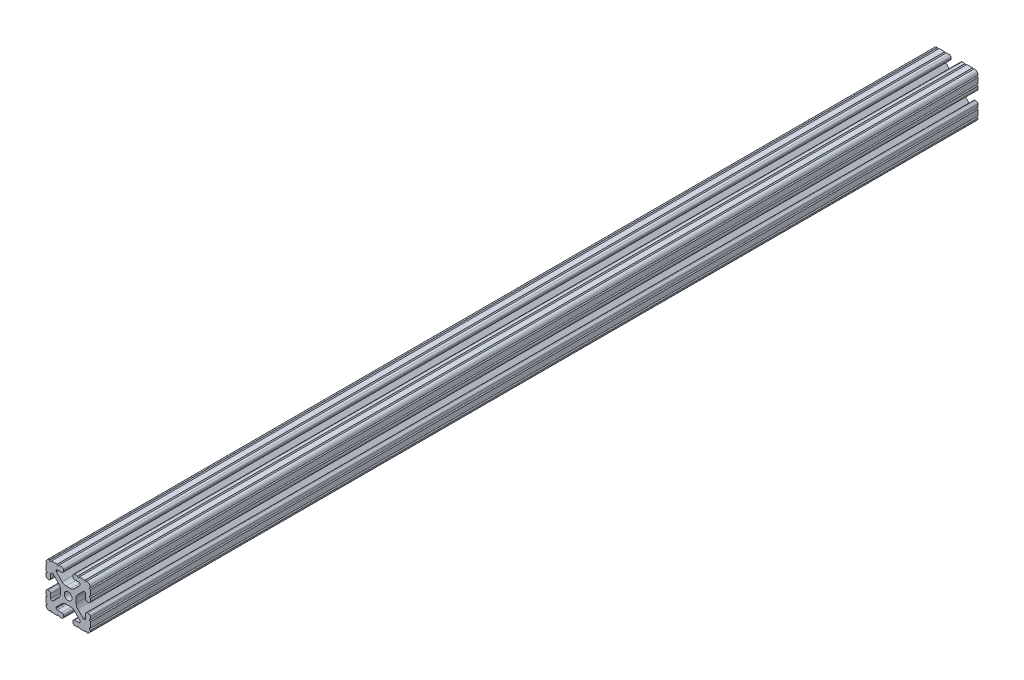
from build123d import *

# Parameters (mm, degrees)
SKETCH11_R                = 3.3274
F_15_1515_PROFILE_1_DEPTH = 762


with BuildPart() as part:
    # Sketch11 → 15 1515 PROFILE(1) (new body)
    with BuildSketch(Plane.YX):
        with BuildLine():
            Line((-10.022898969, 12.91475973), (-5.252158105, 8.144007132))
            ThreePointArc((-5.252158105, 8.144007132), (-3.715177372, 7.117027388), (-1.902183975, 6.7564))
            Line((-1.902183975, 6.7564), (1.902183975, 6.7564))
            ThreePointArc((1.902183975, 6.7564), (3.715177372, 7.117027388), (5.252158105, 8.144007132))
            Line((5.252158105, 8.144007132), (10.022898969, 12.91475973))
            ThreePointArc((10.022898969, 12.91475973), (10.218362387, 13.207291992), (10.287, 13.552357131))
            Line((10.287, 13.552357131), (10.287, 14.0843))
            ThreePointArc((10.287, 14.0843), (10.022898185, 14.721898185), (9.3853, 14.986))
            Line((9.3853, 14.986), (5.617617549, 14.986))
            ThreePointArc((5.617617549, 14.986), (4.519044045, 15.441044045), (4.064, 16.539617549))
            Line((4.064, 16.539617549), (4.064, 17.496382451))
            ThreePointArc((4.064, 17.496382451), (4.519044045, 18.594955955), (5.617617549, 19.05))
            Line((5.617617549, 19.05), (7.974178704, 19.05))
            ThreePointArc((7.974178704, 19.05), (8.736178704, 18.288), (9.498178704, 19.05))
            Line((9.498178704, 19.05), (14.327719207, 19.05))
            ThreePointArc((14.327719207, 19.05), (15.087603123, 18.231251131), (15.847487039, 19.05))
            ThreePointArc((15.847487039, 19.05), (18.120176289, 18.120192083), (19.05, 15.847509295))
            ThreePointArc((19.05, 15.847509295), (18.231250992, 15.08762539), (19.05, 14.327741484))
            Line((19.05, 14.327741484), (19.05, 9.496091471))
            ThreePointArc((19.05, 9.496091471), (18.231250992, 8.736207565), (19.05, 7.97632366))
            Line((19.05, 7.97632366), (19.05, 5.617617549))
            ThreePointArc((19.05, 5.617617549), (18.594955955, 4.519044045), (17.496382451, 4.064))
            Line((17.496382451, 4.064), (16.539617549, 4.064))
            ThreePointArc((16.539617549, 4.064), (15.441044045, 4.519044045), (14.986, 5.617617549))
            Line((14.986, 5.617617549), (14.986, 9.385342516))
            ThreePointArc((14.986, 9.385342516), (14.721898185, 10.022940701), (14.0843, 10.287042516))
            Line((14.0843, 10.287042516), (13.516042086, 10.287042516))
            ThreePointArc((13.516042086, 10.287042516), (13.170975923, 10.218404478), (12.878443117, 10.022939917))
            Line((12.878443117, 10.022939917), (8.14758008, 5.292065243))
            ThreePointArc((8.14758008, 5.292065243), (7.117955879, 3.751120653), (6.7564, 1.933453584))
            Line((6.7564, 1.933453584), (6.7564, -1.933453584))
            ThreePointArc((6.7564, -1.933453584), (7.117955879, -3.751120653), (8.14758008, -5.292065243))
            Line((8.14758008, -5.292065243), (12.878443117, -10.022939917))
            ThreePointArc((12.878443117, -10.022939917), (13.170975923, -10.218404478), (13.516042086, -10.287042516))
            Line((13.516042086, -10.287042516), (14.0843, -10.287042516))
            ThreePointArc((14.0843, -10.287042516), (14.721898185, -10.022940701), (14.986, -9.385342516))
            Line((14.986, -9.385342516), (14.986, -5.617617549))
            ThreePointArc((14.986, -5.617617549), (15.441044045, -4.519044045), (16.539617549, -4.064))
            Line((16.539617549, -4.064), (17.496382451, -4.064))
            ThreePointArc((17.496382451, -4.064), (18.594955955, -4.519044045), (19.05, -5.617617549))
            Line((19.05, -5.617617549), (19.05, -7.976318491))
            ThreePointArc((19.05, -7.976318491), (18.231250992, -8.736202396), (19.05, -9.496086302))
            Line((19.05, -9.496086302), (19.05, -14.32774291))
            ThreePointArc((19.05, -14.32774291), (18.231250992, -15.087626816), (19.05, -15.847510721))
            ThreePointArc((19.05, -15.847510721), (18.120175716, -18.120192644), (15.847486868, -19.05))
            ThreePointArc((15.847486868, -19.05), (15.087602952, -18.231251131), (14.327719036, -19.05))
            Line((14.327719036, -19.05), (9.496062448, -19.05))
            ThreePointArc((9.496062448, -19.05), (8.736178532, -18.231251131), (7.976294616, -19.05))
            Line((7.976294616, -19.05), (5.617617549, -19.05))
            ThreePointArc((5.617617549, -19.05), (4.519044045, -18.594955955), (4.064, -17.496382451))
            Line((4.064, -17.496382451), (4.064, -16.539617549))
            ThreePointArc((4.064, -16.539617549), (4.519044045, -15.441044045), (5.617617549, -14.986))
            Line((5.617617549, -14.986), (9.3853, -14.986))
            ThreePointArc((9.3853, -14.986), (10.022898185, -14.721898185), (10.287, -14.0843))
            Line((10.287, -14.0843), (10.287, -13.552357131))
            ThreePointArc((10.287, -13.552357131), (10.218362387, -13.207291992), (10.022898969, -12.91475973))
            Line((10.022898969, -12.91475973), (5.252158105, -8.144007132))
            ThreePointArc((5.252158105, -8.144007132), (3.715177372, -7.117027388), (1.902183975, -6.7564))
            Line((1.902183975, -6.7564), (-1.902183975, -6.7564))
            ThreePointArc((-1.902183975, -6.7564), (-3.715177372, -7.117027388), (-5.252158105, -8.144007132))
            Line((-5.252158105, -8.144007132), (-10.022898969, -12.91475973))
            ThreePointArc((-10.022898969, -12.91475973), (-10.218362387, -13.207291992), (-10.287, -13.552357131))
            Line((-10.287, -13.552357131), (-10.287, -14.0843))
            ThreePointArc((-10.287, -14.0843), (-10.022898185, -14.721898185), (-9.3853, -14.986))
            Line((-9.3853, -14.986), (-5.617617549, -14.986))
            ThreePointArc((-5.617617549, -14.986), (-4.519044045, -15.441044045), (-4.064, -16.539617549))
            Line((-4.064, -16.539617549), (-4.064, -17.496382451))
            ThreePointArc((-4.064, -17.496382451), (-4.519044045, -18.594955955), (-5.617617549, -19.05))
            Line((-5.617617549, -19.05), (-7.976294616, -19.05))
            ThreePointArc((-7.976294616, -19.05), (-8.736178532, -18.231251131), (-9.496062448, -19.05))
            Line((-9.496062448, -19.05), (-14.327719036, -19.05))
            ThreePointArc((-14.327719036, -19.05), (-15.087602952, -18.231251131), (-15.847486868, -19.05))
            ThreePointArc((-15.847486868, -19.05), (-18.120175716, -18.120192644), (-19.05, -15.847510721))
            ThreePointArc((-19.05, -15.847510721), (-18.231250992, -15.087626816), (-19.05, -14.32774291))
            Line((-19.05, -14.32774291), (-19.05, -9.496086302))
            ThreePointArc((-19.05, -9.496086302), (-18.231250992, -8.736202396), (-19.05, -7.976318491))
            Line((-19.05, -7.976318491), (-19.05, -5.617617549))
            ThreePointArc((-19.05, -5.617617549), (-18.594955955, -4.519044045), (-17.496382451, -4.064))
            Line((-17.496382451, -4.064), (-16.539617549, -4.064))
            ThreePointArc((-16.539617549, -4.064), (-15.441044045, -4.519044045), (-14.986, -5.617617549))
            Line((-14.986, -5.617617549), (-14.986, -9.385342516))
            ThreePointArc((-14.986, -9.385342516), (-14.721898185, -10.022940701), (-14.0843, -10.287042516))
            Line((-14.0843, -10.287042516), (-13.516042086, -10.287042516))
            ThreePointArc((-13.516042086, -10.287042516), (-13.170975923, -10.218404478), (-12.878443117, -10.022939917))
            Line((-12.878443117, -10.022939917), (-8.14758008, -5.292065243))
            ThreePointArc((-8.14758008, -5.292065243), (-7.117955879, -3.751120653), (-6.7564, -1.933453584))
            Line((-6.7564, -1.933453584), (-6.7564, 1.933453584))
            ThreePointArc((-6.7564, 1.933453584), (-7.117955879, 3.751120653), (-8.14758008, 5.292065243))
            Line((-8.14758008, 5.292065243), (-12.878443117, 10.022939917))
            ThreePointArc((-12.878443117, 10.022939917), (-13.170975923, 10.218404478), (-13.516042086, 10.287042516))
            Line((-13.516042086, 10.287042516), (-14.0843, 10.287042516))
            ThreePointArc((-14.0843, 10.287042516), (-14.721898185, 10.022940701), (-14.986, 9.385342516))
            Line((-14.986, 9.385342516), (-14.986, 5.617617549))
            ThreePointArc((-14.986, 5.617617549), (-15.441044045, 4.519044045), (-16.539617549, 4.064))
            Line((-16.539617549, 4.064), (-17.496382451, 4.064))
            ThreePointArc((-17.496382451, 4.064), (-18.594955955, 4.519044045), (-19.05, 5.617617549))
            Line((-19.05, 5.617617549), (-19.05, 7.97632366))
            ThreePointArc((-19.05, 7.97632366), (-18.231250992, 8.736207565), (-19.05, 9.496091471))
            Line((-19.05, 9.496091471), (-19.05, 14.327741484))
            ThreePointArc((-19.05, 14.327741484), (-18.231250992, 15.08762539), (-19.05, 15.847509295))
            ThreePointArc((-19.05, 15.847509295), (-18.120176289, 18.120192083), (-15.847487039, 19.05))
            ThreePointArc((-15.847487039, 19.05), (-15.087603123, 18.231251131), (-14.327719207, 19.05))
            Line((-14.327719207, 19.05), (-9.498178704, 19.05))
            ThreePointArc((-9.498178704, 19.05), (-8.736178704, 18.288), (-7.974178704, 19.05))
            Line((-7.974178704, 19.05), (-5.617617549, 19.05))
            ThreePointArc((-5.617617549, 19.05), (-4.519044045, 18.594955955), (-4.064, 17.496382451))
            Line((-4.064, 17.496382451), (-4.064, 16.539617549))
            ThreePointArc((-4.064, 16.539617549), (-4.519044045, 15.441044045), (-5.617617549, 14.986))
            Line((-5.617617549, 14.986), (-9.3853, 14.986))
            ThreePointArc((-9.3853, 14.986), (-10.022898185, 14.721898185), (-10.287, 14.0843))
            Line((-10.287, 14.0843), (-10.287, 13.552357131))
            ThreePointArc((-10.287, 13.552357131), (-10.218362387, 13.207291992), (-10.022898969, 12.91475973))
        make_face()
        Circle(SKETCH11_R, mode=Mode.SUBTRACT)
    extrude(amount=F_15_1515_PROFILE_1_DEPTH)


solid = part.part
